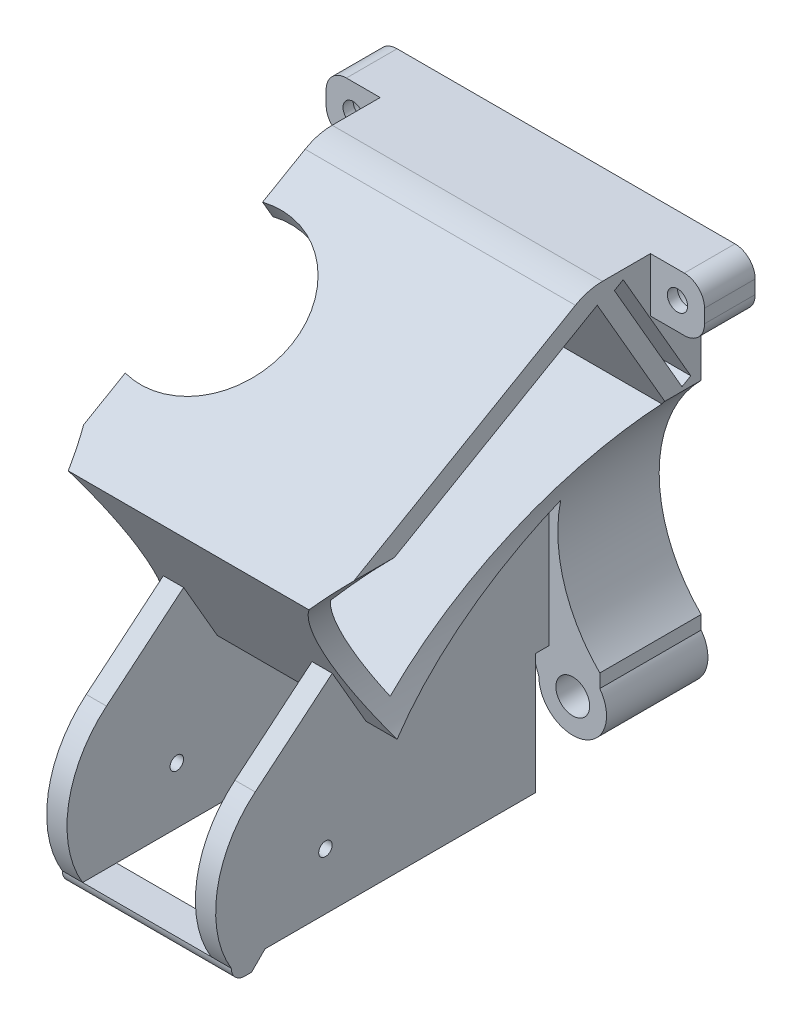
from build123d import *
from build123d.topology import SkipClean

# Parameters (mm, degrees)
CROQUIS2_R               = 2.5
SALIENTE_EXTRUIR1_DEPTH  = 3
SALIENTE_EXTRUIR2_DEPTH  = 40
CROQUIS4_R               = 2.5
SALIENTE_EXTRUIR3_DEPTH  = 12
CROQUIS7_R               = 12
CORTAR_EXTRUIR1_DEPTH    = 3
CORTAR_EXTRUIR2_DEPTH    = 55.85105
CORTAR_EXTRUIR3_DEPTH    = 40
SALIENTE_EXTRUIR7_DEPTH  = 12
CORTAR_EXTRUIR4_START    = -37.06398
CORTAR_EXTRUIR4_DEPTH    = 34.12796
CROQUIS15_R              = 1
SALIENTE_EXTRUIR8_DEPTH  = 3
SALIENTE_EXTRUIR9_START  = 22
CROQUIS15_2_R            = 1
SALIENTE_EXTRUIR9_DEPTH  = 3
REDONDEO2_R              = 8
CROQUIS32_R              = 2.5
SALIENTE_EXTRUIR14_DEPTH = 6
CROQUIS33_R              = 1.5
SALIENTE_EXTRUIR15_DEPTH = 1.5
SALIENTE_EXTRUIR16_START = -25
SALIENTE_EXTRUIR16_DEPTH = 25


with BuildPart() as part:
    # Croquis2 → Saliente-Extruir1 (new body)
    with BuildSketch(Plane.XY):
        with BuildLine():
            Line((-152.030771759, 47.953613054), (-152.030771759, 99.953613054))
            Line((-152.030771759, 99.953613054), (-112.030771759, 99.953613054))
            Line((-112.030771759, 99.953613054), (-112.030771759, 47.953613054))
            ThreePointArc((-112.030771759, 47.953613054), (-114.449632929, 40.210196563), (-121.030771759, 44.953613054))
            Line((-121.030771759, 44.953613054), (-122.85062293, 49.953613054))
            Line((-122.85062293, 49.953613054), (-141.210920588, 49.953613054))
            Line((-141.210920588, 49.953613054), (-143.030771759, 44.953613054))
            ThreePointArc((-143.030771759, 44.953613054), (-149.611910589, 40.210196563), (-152.030771759, 47.953613054))
        make_face()
        with Locations((-148.030771759, 44.953613054)):
            Circle(CROQUIS2_R, mode=Mode.SUBTRACT)
        with Locations((-116.030771759, 44.953613054)):
            Circle(CROQUIS2_R, mode=Mode.SUBTRACT)
    extrude(amount=SALIENTE_EXTRUIR1_DEPTH)

    # Croquis3 → Saliente-Extruir2 (add)
    with BuildSketch(Plane.ZY.offset(152.030771759)):
        Polygon((3, 99.953613054), (16.75, 99.953613054), (55.851046981, 77.378613054), (42.101046981, 53.56291445), (3, 76.13791445), align=None)
        Polygon((15.379903811, 97.280536842), (4.629903811, 78.660990661), (41.00297077, 57.660990661), (51.75297077, 76.280536842), align=None, mode=Mode.SUBTRACT)
    extrude(amount=-SALIENTE_EXTRUIR2_DEPTH)

    # Croquis4 → Saliente-Extruir3 (add)
    # profile 1 of 2: a face of its own
    with BuildSketch(Plane.XY.offset(3)):
        with BuildLine():
            Line((-152.030771759, 47.953613054), (-152.030771759, 49.953613054))
            Line((-152.030771759, 49.953613054), (-148.030771759, 49.953613054))
            ThreePointArc((-148.030771759, 49.953613054), (-145.794703781, 40.481477099), (-152.030771759, 47.953613054))
        make_face()
        with Locations((-148.030771759, 44.953613054)):
            Circle(CROQUIS4_R, mode=Mode.SUBTRACT)
    # profile 2 of 2: a face of its own
    with BuildSketch(Plane.XY.offset(3)):
        with BuildLine():
            Line((-112.030771759, 49.953613054), (-112.030771759, 47.953613054))
            ThreePointArc((-112.030771759, 47.953613054), (-118.266839736, 40.481477099), (-116.030771759, 49.953613054))
            Line((-116.030771759, 49.953613054), (-112.030771759, 49.953613054))
        make_face()
        with Locations((-116.030771759, 44.953613054)):
            Circle(CROQUIS4_R, mode=Mode.SUBTRACT)
    extrude(amount=SALIENTE_EXTRUIR3_DEPTH)

    # Croquis7 → Cortar-Extruir1 (cut)
    with BuildSketch(Plane(origin=(0, 82.218172547, 47.468684052), x_dir=(1, 0, 0), z_dir=(0, 0.8660254037844387, 0.4999999999999998))):
        with Locations((-149.530771759, 14.320881013)):
            Circle(CROQUIS7_R)
    extrude(amount=-CORTAR_EXTRUIR1_DEPTH, mode=Mode.SUBTRACT)

    # Croquis10 → Cortar-Extruir2 (cut)
    with BuildSketch(Plane(origin=(0, 0, 0), x_dir=(-1, 0, 0), z_dir=(0, 0, -1))):
        with BuildLine():
            Line((152.030771759, 79.953613054), (152.030771759, 49.953613054))
            ThreePointArc((152.030771759, 49.953613054), (145.817568323, 64.953613054), (152.030771759, 79.953613054))
        make_face()
        with BuildLine():
            Line((112.030771759, 79.953613054), (112.030771759, 49.953613054))
            ThreePointArc((112.030771759, 49.953613054), (118.243975195, 64.953613054), (112.030771759, 79.953613054))
        make_face()
    extrude(amount=-CORTAR_EXTRUIR2_DEPTH, mode=Mode.SUBTRACT)

    # Croquis11 → Cortar-Extruir3 (cut)
    with BuildSketch(Plane.ZY.offset(152.030771759)):
        Polygon((12.839840301, 97.881017789), (2.839840301, 80.560509714), (1.540802195, 81.310509714), (11.540802195, 98.631017789), align=None)
    extrude(amount=-CORTAR_EXTRUIR3_DEPTH, mode=Mode.SUBTRACT)

    # Croquis12 → Saliente-Extruir7 (add)
    with SkipClean():  # the faces are left unmerged after this step: merging them gives an invalid solid
        with BuildSketch(Plane.XY.offset(3)):
            with BuildLine():
                Line((-152.030771759, 49.953613054), (-148.030771759, 49.953613054))
                ThreePointArc((-148.030771759, 49.953613054), (-144.495237853, 48.48914696), (-143.030771759, 44.953613054))
                Line((-143.030771759, 44.953613054), (-141.530771759, 49.074829183))
                Line((-141.530771759, 49.074829183), (-141.530771759, 76.13791445))
                Line((-141.530771759, 76.13791445), (-149.005472808, 76.13791445))
                ThreePointArc((-149.005472808, 76.13791445), (-145.957755776, 62.518865142), (-152.030771759, 49.953613054))
            make_face()
            with BuildLine():
                Line((-121.030771759, 44.953613054), (-122.530771759, 49.074829183))
                Line((-122.530771759, 49.074829183), (-122.530771759, 76.13791445))
                Line((-122.530771759, 76.13791445), (-115.05607071, 76.13791445))
                ThreePointArc((-115.05607071, 76.13791445), (-118.103787742, 62.518865142), (-112.030771759, 49.953613054))
                Line((-112.030771759, 49.953613054), (-116.030771759, 49.953613054))
                ThreePointArc((-116.030771759, 49.953613054), (-119.566305665, 48.48914696), (-121.030771759, 44.953613054))
            make_face()
        extrude(amount=SALIENTE_EXTRUIR7_DEPTH)

    # Croquis14 → Cortar-Extruir4 (cut)
    with BuildSketch(Plane.ZY.offset(152.030771759).offset(CORTAR_EXTRUIR4_START)):
        Polygon((15.379903811, 97.280536842), (51.88287458, 76.205536842), (41.13287458, 57.585990661), (4.629903811, 78.660990661), align=None)
    extrude(amount=CORTAR_EXTRUIR4_DEPTH, mode=Mode.SUBTRACT)

    # Croquis15 → Saliente-Extruir8 (add)
    with BuildSketch(Plane(origin=(-141.530771759, 0, 0), x_dir=(0, 0, -1), z_dir=(1, 0, 0))):
        with BuildLine():
            Line((-15, 69.209711219), (-15, 49.709711219))
            Line((-15, 49.709711219), (-17, 49.709711219))
            Line((-17, 49.709711219), (-17, 31.865013093))
            Line((-17, 31.865013093), (-50.633644315, 31.865013093))
            Line((-50.633644315, 31.865013093), (-62.036793098, 31.865013093))
            ThreePointArc((-62.036793098, 31.865013093), (-64.120396014, 42.938683324), (-58.500710752, 52.705295379))
            Line((-58.500710752, 52.705295379), (-47.019992598, 62.269965257))
            Line((-47.019992598, 62.269965257), (-42.019992598, 53.609711219))
            Line((-42.019992598, 53.609711219), (-15, 69.209711219))
        make_face()
        with Locations((-48.09937995, 40.220311696)):
            Circle(CROQUIS15_R, mode=Mode.SUBTRACT)
    extrude(amount=-SALIENTE_EXTRUIR8_DEPTH)

    # Croquis15<2> → Saliente-Extruir9 (add)
    with BuildSketch(Plane(origin=(-141.530771759, 0, 0), x_dir=(0, 0, -1), z_dir=(1, 0, 0)).offset(SALIENTE_EXTRUIR9_START)):
        with BuildLine():
            Line((-15, 69.209711219), (-15, 49.709711219))
            Line((-15, 49.709711219), (-17, 49.709711219))
            Line((-17, 49.709711219), (-17, 31.865013093))
            Line((-17, 31.865013093), (-50.633644315, 31.865013093))
            Line((-50.633644315, 31.865013093), (-62.036793098, 31.865013093))
            ThreePointArc((-62.036793098, 31.865013093), (-64.120396014, 42.938683324), (-58.500710752, 52.705295379))
            Line((-58.500710752, 52.705295379), (-47.019992598, 62.269965257))
            Line((-47.019992598, 62.269965257), (-42.019992598, 53.609711219))
            Line((-42.019992598, 53.609711219), (-15, 69.209711219))
        make_face()
        with Locations((-48.09937995, 40.220311696)):
            Circle(CROQUIS15_2_R, mode=Mode.SUBTRACT)
    extrude(amount=-SALIENTE_EXTRUIR9_DEPTH)

    # Redondeo2
    redondeo2_edges = [part.edges().sort_by_distance(p)[0] for p in [
        (-132.030771759, 99.953613054, 16.75),
    ]]
    fillet(redondeo2_edges, radius=REDONDEO2_R)

    # Croquis32 → Saliente-Extruir14 (add)
    with BuildSketch(Plane(origin=(0, 0, 0), x_dir=(-1, 0, 0), z_dir=(0, 0, -1))):
        with BuildLine():
            Line((112.030771759, 99.953613054), (107.030771759, 99.953613054))
            ThreePointArc((107.030771759, 99.953613054), (104.909451415, 99.074933397), (104.030771759, 96.953613054))
            Line((104.030771759, 96.953613054), (104.030771759, 94.953613054))
            ThreePointArc((104.030771759, 94.953613054), (104.909451415, 92.83229271), (107.030771759, 91.953613054))
            Line((107.030771759, 91.953613054), (112.030771759, 91.953613054))
            Line((112.030771759, 91.953613054), (112.030771759, 99.953613054))
        make_face()
        with Locations((108.030771759, 95.953613054)):
            Circle(CROQUIS32_R, mode=Mode.SUBTRACT)
    saliente_extruir14 = extrude(amount=-SALIENTE_EXTRUIR14_DEPTH)

    # Croquis33 → Saliente-Extruir15 (add)
    with BuildSketch(Plane.XY.offset(6)):
        with BuildLine():
            Line((-112.030771759, 99.953613054), (-107.030771759, 99.953613054))
            ThreePointArc((-107.030771759, 99.953613054), (-104.909451415, 99.074933397), (-104.030771759, 96.953613054))
            Line((-104.030771759, 96.953613054), (-104.030771759, 94.953613054))
            ThreePointArc((-104.030771759, 94.953613054), (-104.909451415, 92.83229271), (-107.030771759, 91.953613054))
            Line((-107.030771759, 91.953613054), (-112.030771759, 91.953613054))
            Line((-112.030771759, 91.953613054), (-112.030771759, 99.953613054))
        make_face()
        with Locations((-108.030771759, 95.953613054)):
            Circle(CROQUIS33_R, mode=Mode.SUBTRACT)
    saliente_extruir15 = extrude(amount=SALIENTE_EXTRUIR15_DEPTH)

    # Simetría1: Saliente-Extruir14, Saliente-Extruir15 across plane
    add(saliente_extruir14.mirror(Plane(origin=(-132.030771759, 0, 0), x_dir=(0, 0, 1), z_dir=(1, 0, 0))))
    add(saliente_extruir15.mirror(Plane(origin=(-132.030771759, 0, 0), x_dir=(0, 0, 1), z_dir=(1, 0, 0))))

    # Croquis36 → Saliente-Extruir16 (add)
    with BuildSketch(Plane.ZY.offset(144.530771759).offset(SALIENTE_EXTRUIR16_START)):
        with BuildLine():
            Line((57.036793098, 31.865013093), (62.036793098, 31.865013093))
            ThreePointArc((62.036793098, 31.865013093), (61.45100666, 30.450799531), (60.036793098, 29.865013093))
            Line((60.036793098, 29.865013093), (59.036793098, 29.865013093))
            Line((59.036793098, 29.865013093), (57.036793098, 31.865013093))
        make_face()
    extrude(amount=SALIENTE_EXTRUIR16_DEPTH)


solid = part.part
